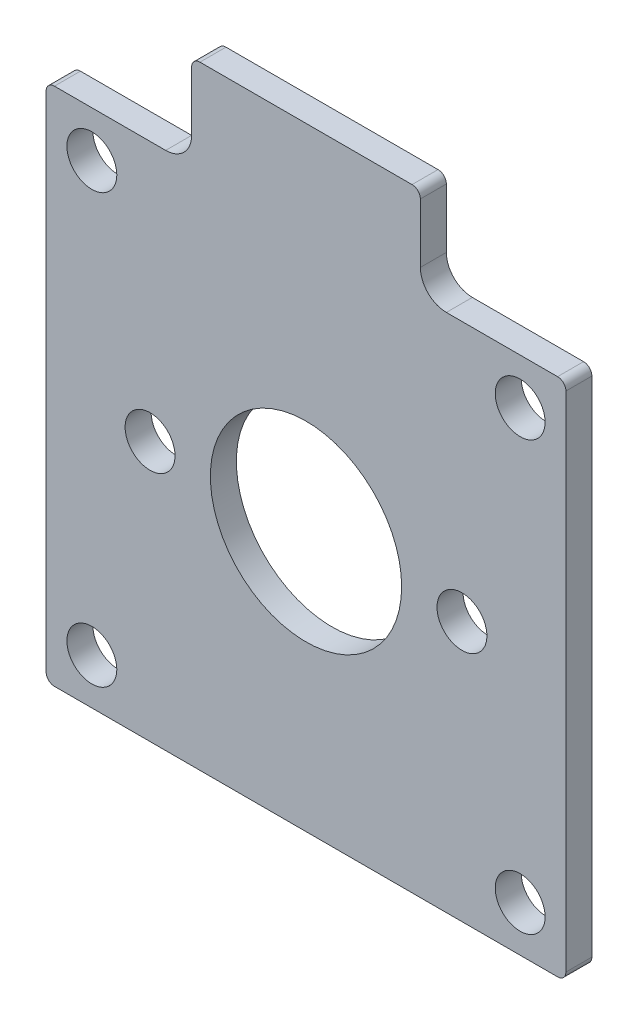
from build123d import *

# Parameters (mm, degrees)
BOSS_EXTRUDE1_DEPTH   = 1.5875
SKETCH2_R             = 5.842
CUT_EXTRUDE1_DEPTH    = 23.50669692
F_4_CLEARANCE_HOLE1_D = 3.048
SKETCH5_W             = 13.97
SKETCH5_H             = 11.43
BOSS_EXTRUDE2_DEPTH   = 1.5875
FILLET1_R             = 1.5875
FILLET2_R             = 0.508


with BuildPart() as part:
    # Sketch1 → Boss-Extrude1 (new body)
    with BuildSketch(Plane.XY):
        with BuildLine():
            Line((15.367, 15.875), (-15.367, 15.875))
            ThreePointArc((-15.367, 15.875), (-15.726210245, 15.726210245), (-15.875, 15.367))
            Line((-15.875, 15.367), (-15.875, -15.367))
            ThreePointArc((-15.875, -15.367), (-15.726210245, -15.726210245), (-15.367, -15.875))
            Line((-15.367, -15.875), (15.367, -15.875))
            ThreePointArc((15.367, -15.875), (15.726210245, -15.726210245), (15.875, -15.367))
            Line((15.875, -15.367), (15.875, 15.367))
            ThreePointArc((15.875, 15.367), (15.726210245, 15.726210245), (15.367, 15.875))
        make_face()
    extrude(amount=BOSS_EXTRUDE1_DEPTH)

    # Sketch2 → Cut-Extrude1 (cut, through all)
    with BuildSketch(Plane.XY.offset(1.5875)):
        Circle(SKETCH2_R)
    extrude(amount=-CUT_EXTRUDE1_DEPTH, mode=Mode.SUBTRACT)

    # #4 Clearance Hole1 (through all)
    with Locations(Plane.XY.offset(1.5875)):
        with Locations((-13.081, 13.081), (13.081, 13.081), (13.081, -13.081), (-13.081, -13.081), (-9.525, 0), (9.525, 0)):
            Hole(F_4_CLEARANCE_HOLE1_D / 2)

    # Sketch5 → Boss-Extrude2 (add, through all)
    with BuildSketch(Plane.XY.offset(1.5875)):
        with Locations((0, 15.875)):
            Rectangle(SKETCH5_W, SKETCH5_H)
    extrude(amount=-BOSS_EXTRUDE2_DEPTH)

    # Fillet1
    fillet1_edges = [part.edges().sort_by_distance(p)[0] for p in [
        (-6.985, 15.875, 0.79375),
        (6.985, 15.875, 0.79375),
    ]]
    fillet(fillet1_edges, radius=FILLET1_R)

    # Fillet2
    fillet2_edges = [part.edges().sort_by_distance(p)[0] for p in [
        (6.985, 21.59, 0.79375),
        (-6.985, 21.59, 0.79375),
    ]]
    fillet(fillet2_edges, radius=FILLET2_R)


solid = part.part
